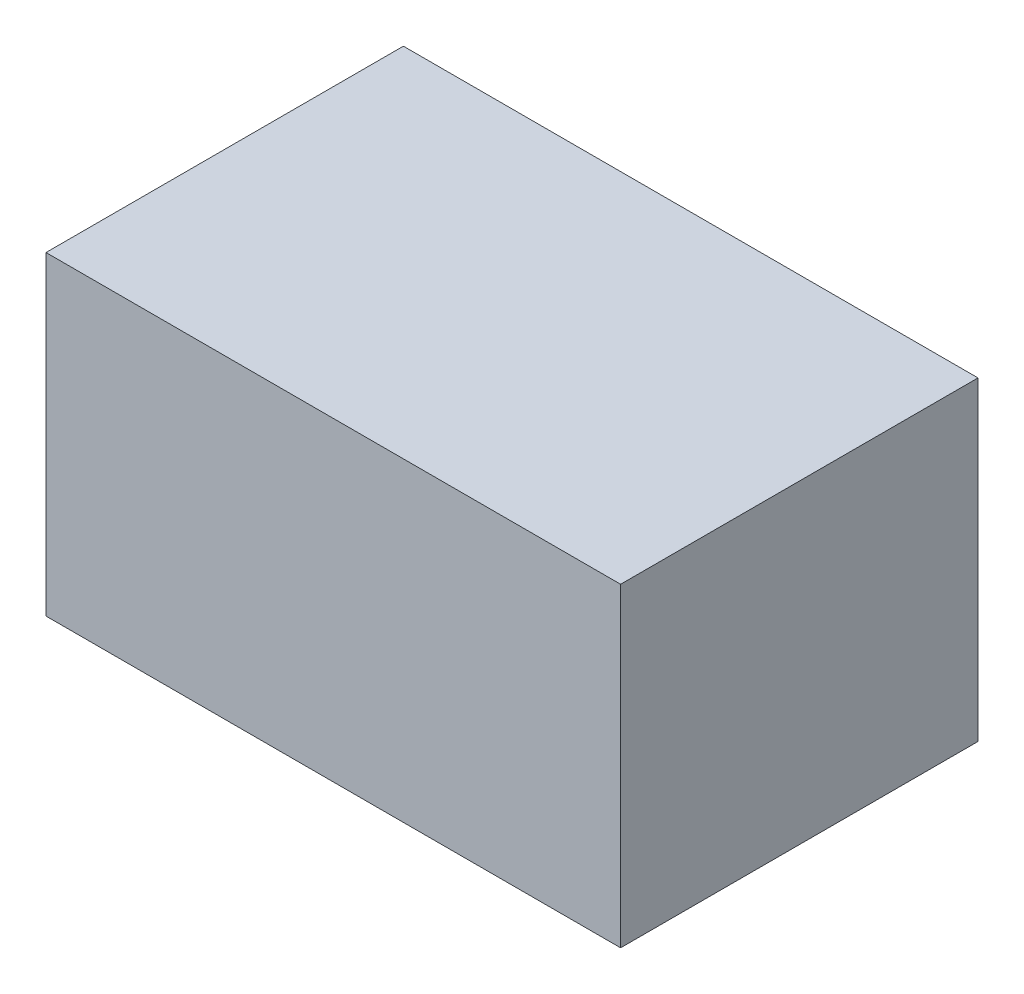
from build123d import *

# Parameters (mm, degrees)
CURVESKETCH_W   = 31.719
CURVESKETCH_H   = 17.381
CURVEBOSS_DEPTH = 19.729


with BuildPart() as part:
    # CurveSketch → CurveBoss (new body)
    with BuildSketch(Plane.XY):
        with Locations((-4.193, 6.827)):
            Rectangle(CURVESKETCH_W, CURVESKETCH_H)
    extrude(amount=CURVEBOSS_DEPTH)


solid = part.part
